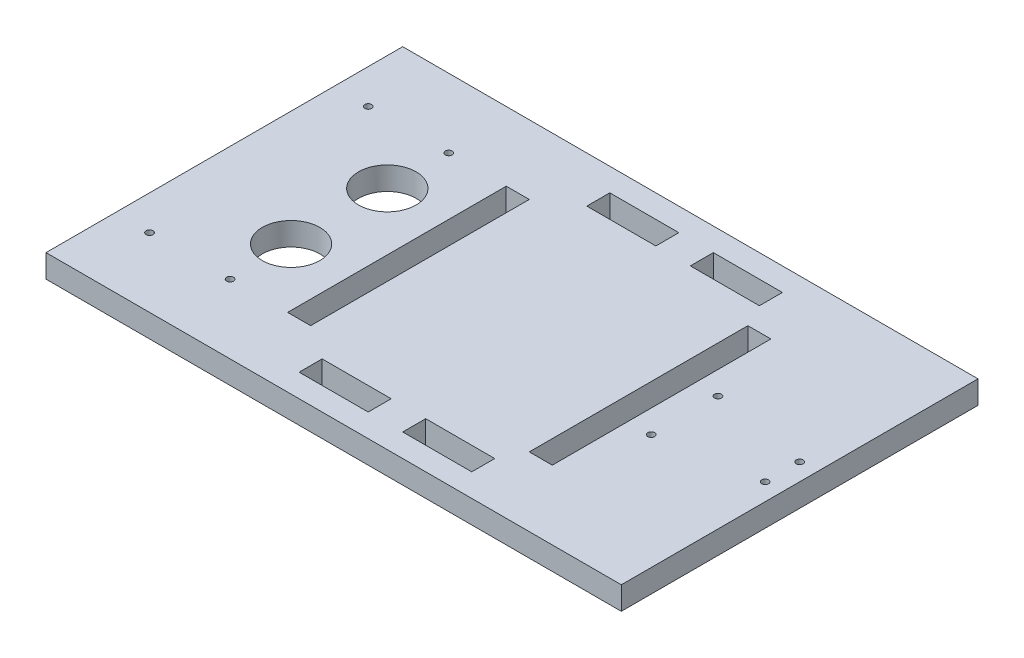
from build123d import *

# Parameters (mm, degrees)
SKETCH4_W               = 250
SKETCH4_H               = 155
BOSS_EXTRUDE2_DEPTH     = 10
SKETCH5_R               = 1.5
CUT_EXTRUDE1_DEPTH      = 10
SKETCH6_R               = 1.5
CUT_EXTRUDE2_DEPTH      = 148.415229878
CUT_EXTRUDE4_DEPTH      = 299.317469373
CUT_EXTRUDE4_DEPTH_BACK = 299.317469373
SKETCH8_R               = 12.5
SKETCH10_R              = 1.5
CUT_EXTRUDE5_DEPTH      = 148.415229878
SKETCH11_W              = 30
SKETCH11_H              = 10
CUT_EXTRUDE6_DEPTH      = 148.415229878
SKETCH12_W              = 30
SKETCH12_H              = 10
CUT_EXTRUDE7_DEPTH      = 148.415229878
SKETCH14_R              = 1.5
CUT_EXTRUDE8_DEPTH      = 148.415229878
SKETCH16_W              = 10
SKETCH16_H              = 95
CUT_EXTRUDE9_DEPTH      = 10


with BuildPart() as part:
    # Sketch4 → Boss-Extrude2 (new body)
    with BuildSketch(Plane(origin=(0, 0, 0), x_dir=(1, 0, 0), z_dir=(0, 1, 0))):
        Rectangle(SKETCH4_W, SKETCH4_H)
    extrude(amount=BOSS_EXTRUDE2_DEPTH)

    # Sketch5 → Cut-Extrude1 (cut)
    with BuildSketch(Plane.XZ):
        with Locations(Location((-110, 47.5, 0), (0, 0, 270))):
            Circle(SKETCH5_R)
    cut_extrude1 = extrude(amount=-CUT_EXTRUDE1_DEPTH, mode=Mode.SUBTRACT)

    # Mirror1: Cut-Extrude1 across plane
    add(cut_extrude1.mirror(Plane.XY), mode=Mode.SUBTRACT)

    # Sketch6 → Cut-Extrude2 (cut, symmetric)
    with BuildSketch(Plane.XZ):
        with Locations(Location((75, 14.5, 0), (0, 0, 270))):
            Circle(SKETCH6_R)
    cut_extrude2 = extrude(amount=CUT_EXTRUDE2_DEPTH, both=True, mode=Mode.SUBTRACT)

    # Mirror2: Cut-Extrude2 across plane
    add(cut_extrude2.mirror(Plane.XY), mode=Mode.SUBTRACT)

    # Sketch8 → Cut-Extrude4 (cut, two sides: drawn at the far end of the back side and taken through both)
    with BuildSketch(Plane(origin=(-47.523167836, 19.5, 165.087755447), x_dir=(1, 0, 0), z_dir=(0, 1, 0)).offset(-CUT_EXTRUDE4_DEPTH_BACK)):
        with Locations(Location((-27.476832164, 144.087755447, 0), (0, 0, 270))):
            Circle(SKETCH8_R)
        with Locations(Location((-27.476832164, 185.912244553, 0), (0, 0, 270))):
            Circle(SKETCH8_R)
    extrude(amount=CUT_EXTRUDE4_DEPTH + CUT_EXTRUDE4_DEPTH_BACK, mode=Mode.SUBTRACT)

    # Sketch10 → Cut-Extrude5 (cut, symmetric)
    with BuildSketch(Plane(origin=(0, 0, 0), x_dir=(-1, 0, 0), z_dir=(0, -1, 0))):
        with Locations(Location((75, -47.5, 0), (0, 0, 90))):
            Circle(SKETCH10_R)
    cut_extrude5 = extrude(amount=CUT_EXTRUDE5_DEPTH, both=True, mode=Mode.SUBTRACT)

    # Mirror3: Cut-Extrude5 across plane
    add(cut_extrude5.mirror(Plane.XY), mode=Mode.SUBTRACT)

    # Sketch11 → Cut-Extrude6 (cut, symmetric)
    with BuildSketch(Plane.XZ):
        with Locations((-10, 62.5)):
            Rectangle(SKETCH11_W, SKETCH11_H)
    cut_extrude6 = extrude(amount=CUT_EXTRUDE6_DEPTH, both=True, mode=Mode.SUBTRACT)

    # Sketch12 → Cut-Extrude7 (cut, symmetric)
    with BuildSketch(Plane(origin=(0, 0, 0), x_dir=(-1, 0, 0), z_dir=(0, -1, 0))):
        with Locations((-35, -62.5)):
            Rectangle(SKETCH12_W, SKETCH12_H)
    cut_extrude7 = extrude(amount=CUT_EXTRUDE7_DEPTH, both=True, mode=Mode.SUBTRACT)

    # Mirror4: Cut-Extrude6, Cut-Extrude7 across plane
    add(cut_extrude6.mirror(Plane.XY), mode=Mode.SUBTRACT)
    add(cut_extrude7.mirror(Plane.XY), mode=Mode.SUBTRACT)

    # Sketch14 → Cut-Extrude8 (cut, symmetric)
    with BuildSketch(Plane.XZ):
        with Locations(Location((117.5, 7.5, 0), (0, 0, 270))):
            Circle(SKETCH14_R)
    cut_extrude8 = extrude(amount=CUT_EXTRUDE8_DEPTH, both=True, mode=Mode.SUBTRACT)

    # Mirror5: Cut-Extrude8 across plane
    add(cut_extrude8.mirror(Plane.XY), mode=Mode.SUBTRACT)

    # Sketch16 → Cut-Extrude9 (cut)
    with BuildSketch(Plane(origin=(-47.523167836, 10, 165.087755447), x_dir=(1, 0, 0), z_dir=(0, 1, 0))):
        with Locations((107.523167836, 165.087755447)):
            Rectangle(SKETCH16_W, SKETCH16_H)
        with Locations((2.523167836, 165.087755447)):
            Rectangle(SKETCH16_W, SKETCH16_H)
    extrude(amount=-CUT_EXTRUDE9_DEPTH, mode=Mode.SUBTRACT)


solid = part.part
